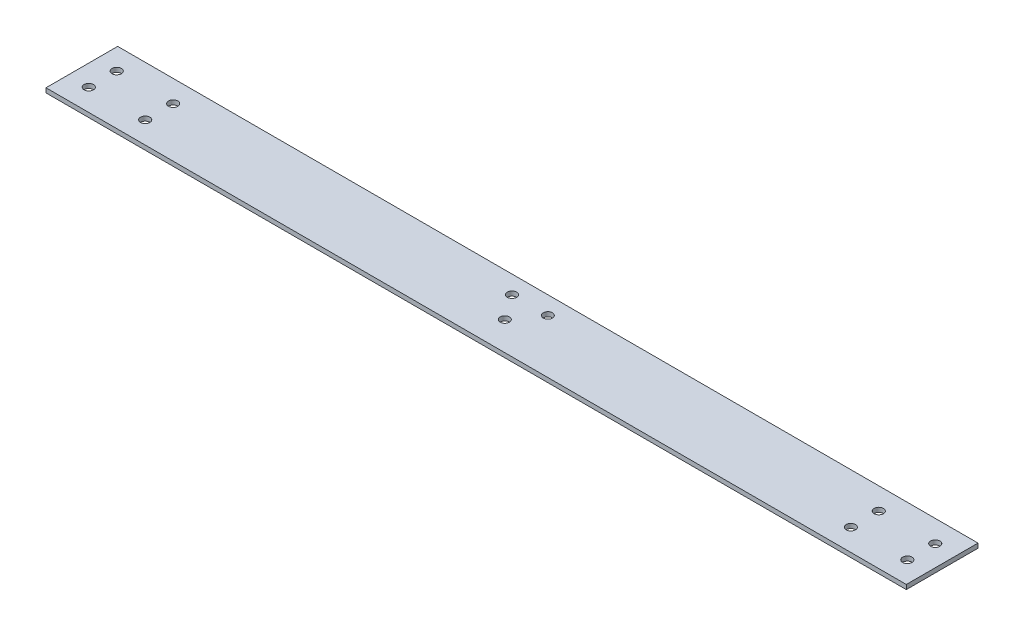
from build123d import *

# Parameters (mm, degrees)
SKETCH1_W                      = 609.6
SKETCH1_H                      = 50.8
SKETCH1_R                      = 3.3
BOSS_EXTRUDE1_DEPTH            = 1.5875
SKETCH2_R                      = 3.2639
F_1_4_20_FOR_NUT_BRACKET_DEPTH = 306.872981195


with BuildPart() as part:
    # Sketch1 → Boss-Extrude1 (new, symmetric)
    with BuildSketch(Plane(origin=(0, 0, 0), x_dir=(1, 0, 0), z_dir=(0, 1, 0))):
        Rectangle(SKETCH1_W, SKETCH1_H)
        with Locations(Location((-250, 9.9, 0), (0, 0, 270))):
            Circle(SKETCH1_R, mode=Mode.SUBTRACT)
        with Locations(Location((-250, -9.9, 0), (0, 0, 90))):
            Circle(SKETCH1_R, mode=Mode.SUBTRACT)
        with Locations(Location((-290, 9.9, 0), (0, 0, 270))):
            Circle(SKETCH1_R, mode=Mode.SUBTRACT)
        with Locations(Location((-290, -9.9, 0), (0, 0, 270))):
            Circle(SKETCH1_R, mode=Mode.SUBTRACT)
        with Locations(Location((290, -9.9, 0), (0, 0, 90))):
            Circle(SKETCH1_R, mode=Mode.SUBTRACT)
        with Locations(Location((290, 9.9, 0), (0, 0, 90))):
            Circle(SKETCH1_R, mode=Mode.SUBTRACT)
        with Locations(Location((250, -9.9, 0), (0, 0, 270))):
            Circle(SKETCH1_R, mode=Mode.SUBTRACT)
        with Locations(Location((250, 9.9, 0), (0, 0, 90))):
            Circle(SKETCH1_R, mode=Mode.SUBTRACT)
    extrude(amount=BOSS_EXTRUDE1_DEPTH, both=True)

    # Sketch2 → 1/4-20 For Nut Bracket (cut, through all)
    with BuildSketch(Plane(origin=(0, 1.5875, 0), x_dir=(1, 0, 0), z_dir=(0, 1, 0))):
        with Locations(Location((-12.7, 12.7, 0), (0, 0, 270))):
            Circle(SKETCH2_R)
        with Locations(Location((12.7, 12.7, 0), (0, 0, 270))):
            Circle(SKETCH2_R)
        with Locations(Location((0, -5.08, 0), (0, 0, 270))):
            Circle(SKETCH2_R)
    extrude(amount=-F_1_4_20_FOR_NUT_BRACKET_DEPTH, mode=Mode.SUBTRACT)


solid = part.part
